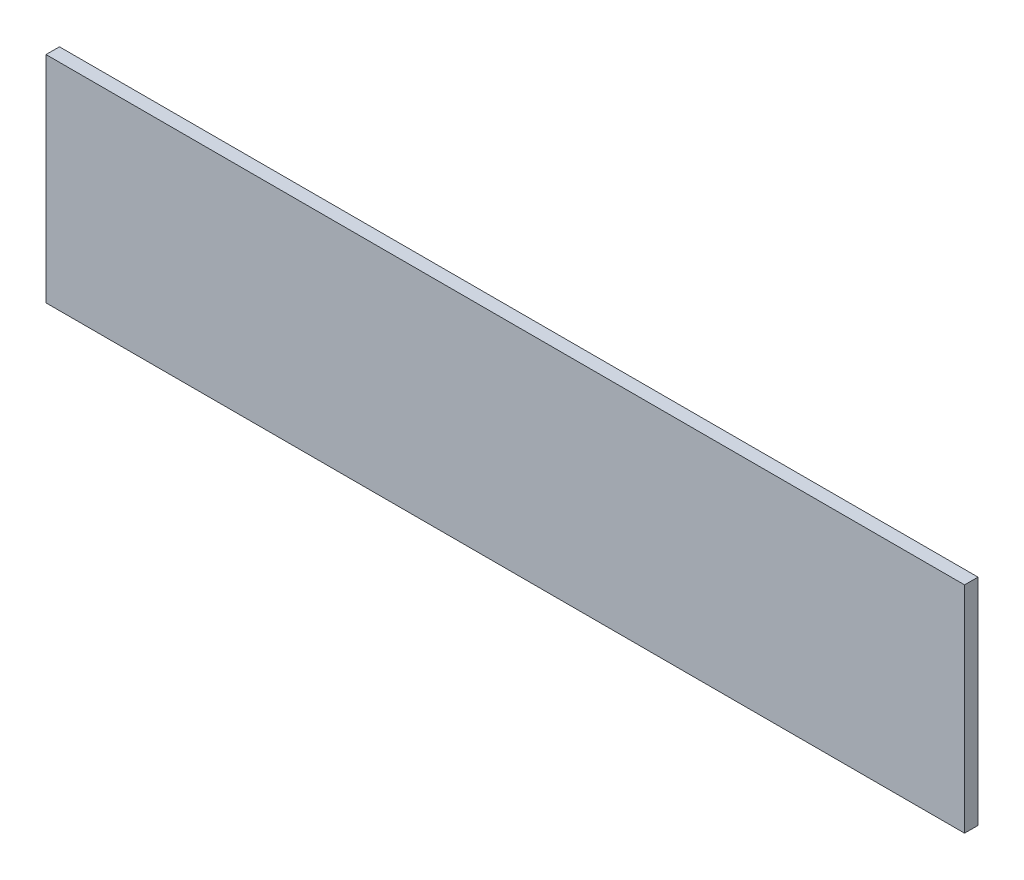
from build123d import *

# Parameters (mm, degrees)
SKETCH1_W           = 205
SKETCH1_H           = 48
BOSS_EXTRUDE1_DEPTH = 3


with BuildPart() as part:
    # Sketch1 → Boss-Extrude1 (new body)
    with BuildSketch(Plane.XY):
        Rectangle(SKETCH1_W, SKETCH1_H)
    extrude(amount=BOSS_EXTRUDE1_DEPTH)


solid = part.part
